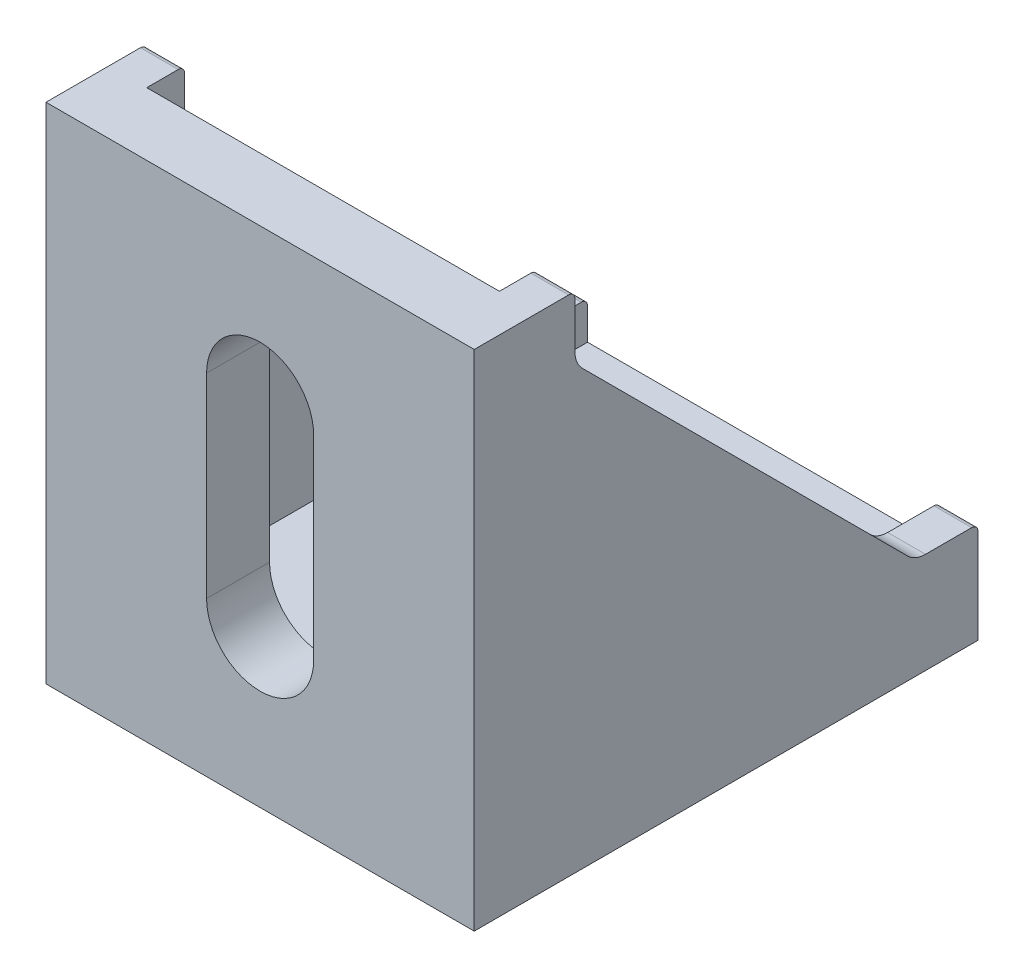
from build123d import *

# Parameters (mm, degrees)
BOSS_EXTRUDE1_DEPTH = 34
CUT_EXTRUDE1_DEPTH  = 35
CUT_EXTRUDE2_DEPTH  = 35
CUT_EXTRUDE3_DEPTH  = 35


with BuildPart() as part:
    # Sketch1 → Boss-Extrude1 (new body)
    with BuildSketch(Plane(origin=(0, 0, 0), x_dir=(0, 0, -1), z_dir=(1, 0, 0))):
        with BuildLine():
            Line((-20, -20), (20, -20))
            Line((20, -20), (20, -12.5))
            ThreePointArc((20, -12.5), (19.853553391, -12.146446609), (19.5, -12))
            Line((19.5, -12), (15.828427125, -12))
            ThreePointArc((15.828427125, -12), (15.06306026, -11.847759065), (14.414213562, -11.414213562))
            Line((14.414213562, -11.414213562), (-11.414213562, 14.414213562))
            ThreePointArc((-11.414213562, 14.414213562), (-11.847759065, 15.06306026), (-12, 15.828427125))
            Line((-12, 15.828427125), (-12, 19.5))
            ThreePointArc((-12, 19.5), (-12.146446609, 19.853553391), (-12.5, 20))
            Line((-12.5, 20), (-20, 20))
            Line((-20, 20), (-20, -20))
        make_face()
    extrude(amount=BOSS_EXTRUDE1_DEPTH)

    # Sketch2 → Cut-Extrude1 (cut)
    with BuildSketch(Plane(origin=(0, 20, 0), x_dir=(1, 0, 0), z_dir=(0, 1, 0))):
        Polygon((31, -15), (3, -15), (3, -12), (3, 23.612477871), (31, 23.612477871), (31, -12), align=None)
    extrude(amount=-CUT_EXTRUDE1_DEPTH, mode=Mode.SUBTRACT)

    # Sketch4 → Cut-Extrude2 (cut)
    with BuildSketch(Plane.XZ.offset(20)):
        with BuildLine():
            Line((12.75, 7.75), (12.75, -7.75))
            ThreePointArc((12.75, -7.75), (17, -12), (21.25, -7.75))
            Line((21.25, -7.75), (21.25, 7.75))
            ThreePointArc((21.25, 7.75), (17, 12), (12.75, 7.75))
        make_face()
    extrude(amount=-CUT_EXTRUDE2_DEPTH, mode=Mode.SUBTRACT)

    # Sketch5 → Cut-Extrude3 (cut)
    with BuildSketch(Plane.XY.offset(20)):
        with BuildLine():
            Line((12.75, 7.75), (12.75, -7.75))
            ThreePointArc((12.75, -7.75), (17, -12), (21.25, -7.75))
            Line((21.25, -7.75), (21.25, 7.75))
            ThreePointArc((21.25, 7.75), (17, 12), (12.75, 7.75))
        make_face()
    extrude(amount=-CUT_EXTRUDE3_DEPTH, mode=Mode.SUBTRACT)


solid = part.part
